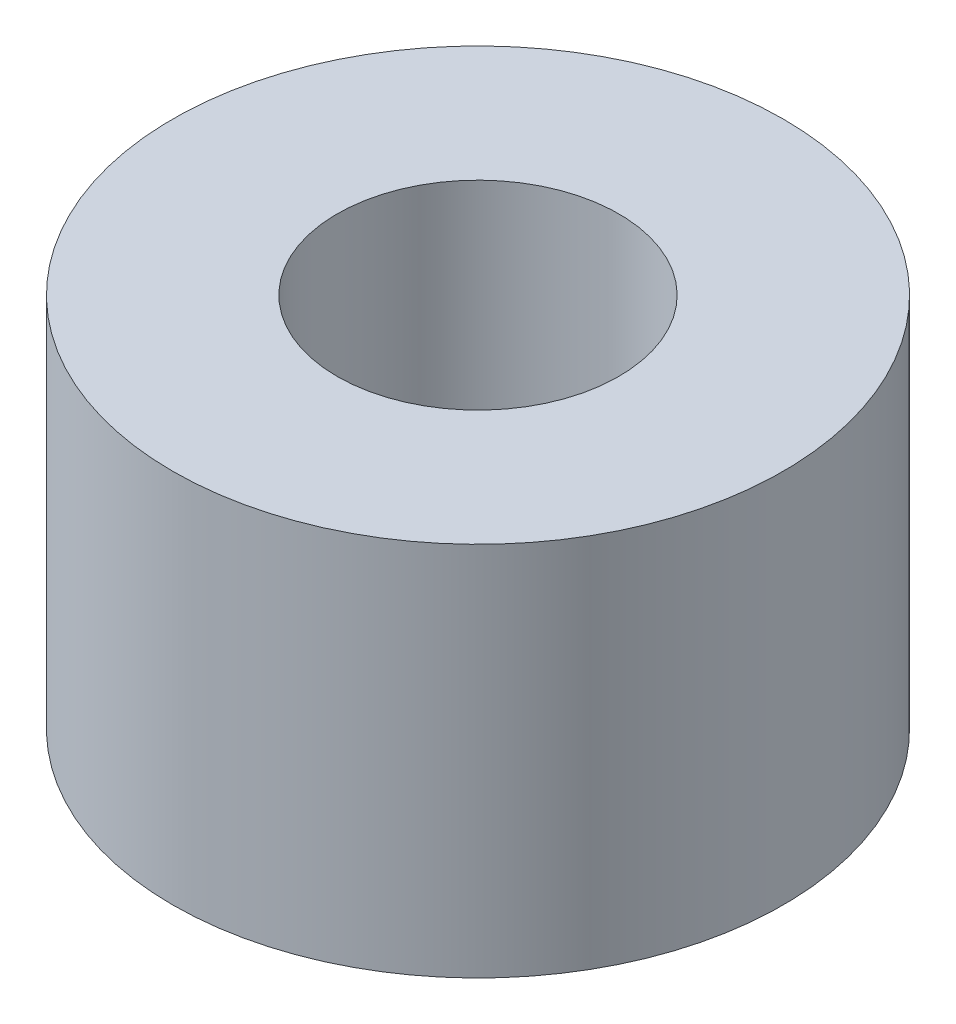
from build123d import *

# Parameters (mm, degrees)
ESQUISSE2_R             = 3.25
BOSS_EXTRU_1_DEPTH      = 4
ESQUISSE1_R             = 1.5
ENL_V_MAT_EXTRU_1_DEPTH = 28


with BuildPart() as part:
    # Esquisse2 → Boss.-Extru.1 (new body)
    with BuildSketch(Plane(origin=(0, 0, 0), x_dir=(1, 0, 0), z_dir=(0, 1, 0))):
        with Locations(Location((0, 0, 0), (0, 0, 270))):
            Circle(ESQUISSE2_R)
    extrude(amount=BOSS_EXTRU_1_DEPTH)

    # Esquisse1 → Enlèv. mat.-Extru.1 (cut)
    with BuildSketch(Plane(origin=(0, 0, 0), x_dir=(1, 0, 0), z_dir=(0, 1, 0))):
        with Locations(Location((0, 0, 0), (0, 0, 270))):
            Circle(ESQUISSE1_R)
    extrude(amount=ENL_V_MAT_EXTRU_1_DEPTH, mode=Mode.SUBTRACT)


solid = part.part
